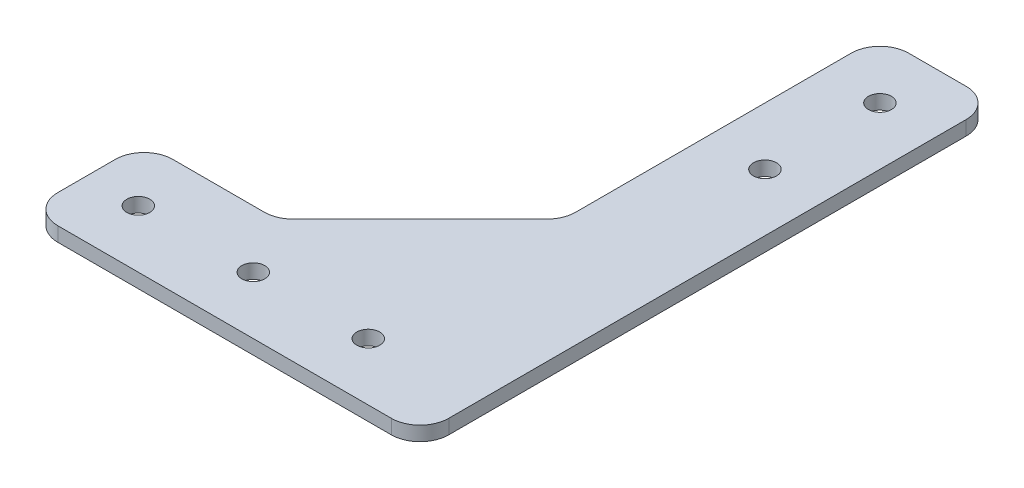
from build123d import *

# Parameters (mm, degrees)
SKETCH1_R           = 2.54
BOSS_EXTRUDE1_DEPTH = 3.175
CHAMFER1_SIZE       = 31.75
FILLET1_R           = 6.35


with BuildPart() as part:
    # Sketch1 → Boss-Extrude1 (new body)
    with BuildSketch(Plane(origin=(0, 0, 0), x_dir=(1, 0, 0), z_dir=(0, 1, 0))):
        Polygon((25.4, 0), (0, 0), (0, -101.6), (-60.96, -101.6), (-60.96, -127), (25.4, -127), align=None)
        with Locations(Location((1.27, -114.3, 0), (0, 0, 270))):
            Circle(SKETCH1_R, mode=Mode.SUBTRACT)
        with Locations(Location((12.7, -12.7, 0), (0, 0, 270))):
            Circle(SKETCH1_R, mode=Mode.SUBTRACT)
        with Locations(Location((12.7, -38.1, 0), (0, 0, 270))):
            Circle(SKETCH1_R, mode=Mode.SUBTRACT)
        with Locations(Location((-24.13, -114.3, 0), (0, 0, 270))):
            Circle(SKETCH1_R, mode=Mode.SUBTRACT)
        with Locations(Location((-49.53, -114.3, 0), (0, 0, 270))):
            Circle(SKETCH1_R, mode=Mode.SUBTRACT)
    extrude(amount=BOSS_EXTRUDE1_DEPTH)

    # Chamfer1
    chamfer1_edges = [part.edges().sort_by_distance(p)[0] for p in [
        (0, 1.5875, 101.6),
    ]]
    chamfer(chamfer1_edges, length=CHAMFER1_SIZE)

    # Fillet1
    fillet1_edges = [part.edges().sort_by_distance(p)[0] for p in [
        (-60.96, 1.5875, 101.6),
        (0, 1.5875, 0),
        (25.4, 1.5875, 0),
        (25.4, 1.5875, 127),
        (-60.96, 1.5875, 127),
        (-31.75, 1.5875, 101.6),
        (0, 1.5875, 69.85),
    ]]
    fillet(fillet1_edges, radius=FILLET1_R)


solid = part.part
